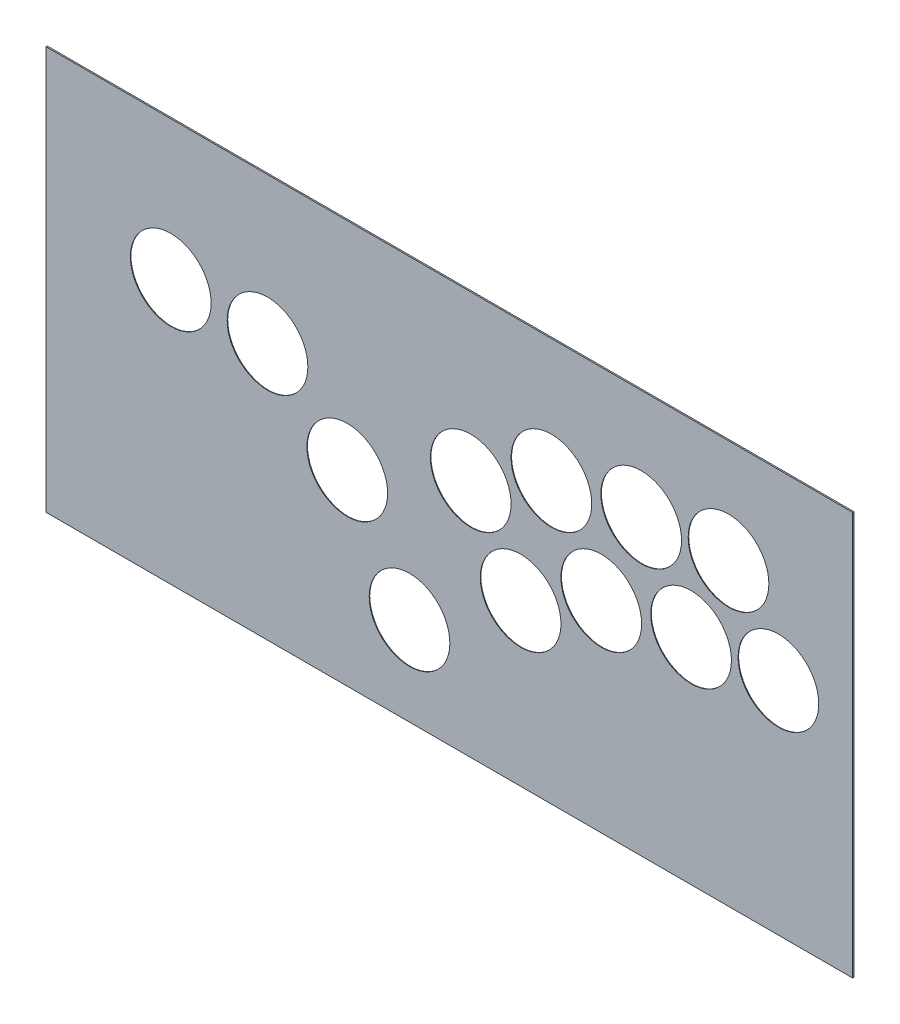
from build123d import *

# Parameters (mm, degrees)
SKETCH1_W           = 5080
SKETCH1_H           = 2540
SKETCH1_R           = 254
BOSS_EXTRUDE1_DEPTH = 8
CHAMFER1_SIZE       = 5
CHAMFER2_SIZE       = 5


with BuildPart() as part:
    # Sketch1 → Boss-Extrude1 (new body)
    with BuildSketch(Plane.XY):
        with Locations((316.149762546, 248.021082972)):
            Rectangle(SKETCH1_W, SKETCH1_H)
        with Locations((-1438.697268441, 638.61973093)):
            Circle(SKETCH1_R, mode=Mode.SUBTRACT)
        with Locations((-829.234689967, 595.778397757)):
            Circle(SKETCH1_R, mode=Mode.SUBTRACT)
        with Locations((-326.904160186, 157.84489308)):
            Circle(SKETCH1_R, mode=Mode.SUBTRACT)
        with Locations((65.17720877, -464.022155912)):
            Circle(SKETCH1_R, mode=Mode.SUBTRACT)
        with Locations((450.852764313, 488.007227932)):
            Circle(SKETCH1_R, mode=Mode.SUBTRACT)
        with Locations((958.852764313, 742.007227932)):
            Circle(SKETCH1_R, mode=Mode.SUBTRACT)
        with Locations((1524.554395699, 825.977687935)):
            Circle(SKETCH1_R, mode=Mode.SUBTRACT)
        with Locations((2074.499177688, 864.058855361)):
            Circle(SKETCH1_R, mode=Mode.SUBTRACT)
        with Locations((765.106903992, -9.428110757)):
            Circle(SKETCH1_R, mode=Mode.SUBTRACT)
        with Locations((1273.106903992, 244.571889243)):
            Circle(SKETCH1_R, mode=Mode.SUBTRACT)
        with Locations((1838.808535378, 328.542349246)):
            Circle(SKETCH1_R, mode=Mode.SUBTRACT)
        with Locations((2388.753317367, 366.623516672)):
            Circle(SKETCH1_R, mode=Mode.SUBTRACT)
    extrude(amount=BOSS_EXTRUDE1_DEPTH)

    # Chamfer1
    chamfer1_edges = [part.edges().sort_by_distance(p)[0] for p in [
        (1820.499177688, 864.058855361, 0),
        (2134.753317367, 366.623516672, 0),
    ]]
    chamfer(chamfer1_edges, length=CHAMFER1_SIZE)

    # Chamfer2
    chamfer2_edges = [part.edges().sort_by_distance(p)[0] for p in [
        (-1692.697268441, 638.61973093, 0),
        (-1083.234689967, 595.778397757, 0),
        (-580.904160186, 157.84489308, 0),
        (-188.82279123, -464.022155912, 0),
        (196.852764313, 488.007227932, 0),
        (704.852764313, 742.007227932, 0),
        (1270.554395699, 825.977687935, 0),
        (511.106903992, -9.428110757, 0),
        (1019.106903992, 244.571889243, 0),
        (1584.808535378, 328.542349246, 0),
    ]]
    chamfer(chamfer2_edges, length=CHAMFER2_SIZE)


solid = part.part
